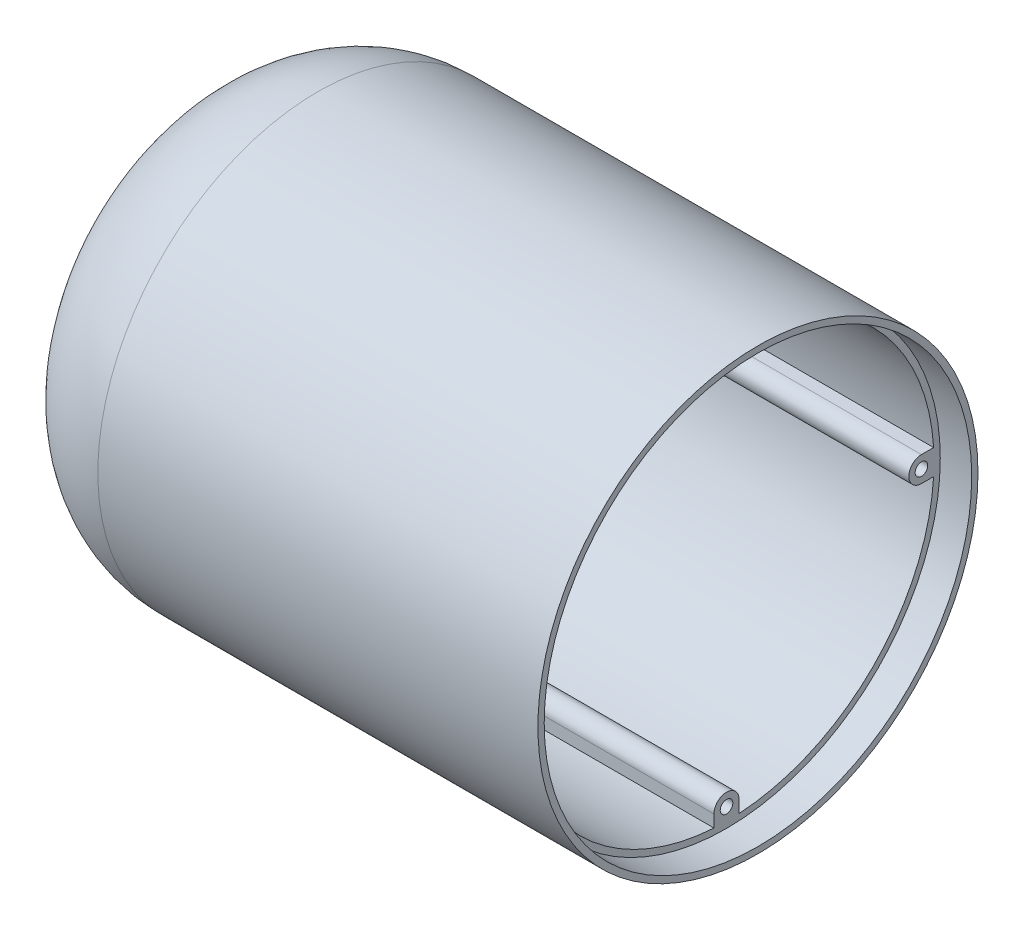
from build123d import *

# Parameters (mm, degrees)
THICKEN1_T2                     = 2
SURFACE_EXTRUDE1_2_DEPTH        = 65
THICKEN2_T1                     = 2
BOSS_EXTRUDE2_REACH             = 83.701
BOSS_EXTRUDE2_END_MAJOR_RADIUS  = 15
BOSS_EXTRUDE2_END_MINOR_RADIUS  = 18
BOSS_EXTRUDE2_DIRECTION_2_DEPTH = 65
SKETCH5_R                       = 1
CUT_EXTRUDE2_DEPTH              = 65
SURFACE_EXTRUDE2_3_DEPTH        = 5
THICKEN3_T1                     = 1


with BuildPart() as body_1:
    # Surface-Revolve1: a surface, the sketch's curves turned about an axis
    with BuildLine(Plane(origin=(0, 0, 0), x_dir=(1, 0, 0), z_dir=(0, 1, 0)), mode=Mode.PRIVATE) as surface_revolve1_1_path:
        Line((0, 0), (0, 15))
        ThreePointArc((0, 15), (5.857864376, 29.142135624), (20, 35))
    surface_revolve1_1 = Shell.revolve(surface_revolve1_1_path.wire(), 360, Axis((0, 0, 0), (1, 0, 0)))
    add(Solid.thicken(surface_revolve1_1, -THICKEN1_T2))

    # Surface-Extrude1: a surface, the sketch's curves swept straight by 65 mm
    with BuildLine(Plane(origin=(20, 0, 0), x_dir=(0, 0, -1), z_dir=(1, 0, 0)), mode=Mode.PRIVATE) as surface_extrude1_2_path:
        CenterArc((0, 0), 35, 0, 360)
    surface_extrude1_2 = Shell.extrude(surface_extrude1_2_path.wire(), (1 * SURFACE_EXTRUDE1_2_DEPTH, 0 * SURFACE_EXTRUDE1_2_DEPTH, 0 * SURFACE_EXTRUDE1_2_DEPTH))
    add(Solid.thicken(surface_extrude1_2, THICKEN2_T1))

    # Boss-Extrude2: up to this torus (the profile starts inside it)
    boss_extrude2_end = Plane(origin=(20, 0, 0), z_dir=(1, 0, 0)) * Torus(BOSS_EXTRUDE2_END_MAJOR_RADIUS, BOSS_EXTRUDE2_END_MINOR_RADIUS, mode=Mode.PRIVATE)
    # Sketch2 → Boss-Extrude2 (add, up to the surface)
    with BuildSketch(Plane(origin=(20, 0, 0), x_dir=(0, 0, -1), z_dir=(1, 0, 0)), mode=Mode.PRIVATE) as boss_extrude2_sk1:
        with BuildLine():
            Line((-2, 31), (-2, 33))
            Line((-2, 33), (2, 33))
            Line((2, 33), (2, 31))
            ThreePointArc((2, 31), (0, 29), (-2, 31))
        make_face()
    boss_extrude2_tool1 = extrude(boss_extrude2_sk1.sketch, amount=-BOSS_EXTRUDE2_REACH, mode=Mode.PRIVATE) & boss_extrude2_end
    add(boss_extrude2_tool1.solids().sort_by_distance((20, 31.1867, 0))[0])
    # Sketch2 → Boss-Extrude2 (add, up to the surface)
    with BuildSketch(Plane(origin=(20, 0, 0), x_dir=(0, 0, -1), z_dir=(1, 0, 0)), mode=Mode.PRIVATE) as boss_extrude2_sk2:
        with BuildLine():
            Line((-31, -2), (-33, -2))
            Line((-33, -2), (-33, 2))
            Line((-33, 2), (-31, 2))
            ThreePointArc((-31, 2), (-29, 0), (-31, -2))
        make_face()
    boss_extrude2_tool2 = extrude(boss_extrude2_sk2.sketch, amount=-BOSS_EXTRUDE2_REACH, mode=Mode.PRIVATE) & boss_extrude2_end
    add(boss_extrude2_tool2.solids().sort_by_distance((20, 0, 31.1867))[0])
    # Sketch2 → Boss-Extrude2 (add, up to the surface)
    with BuildSketch(Plane(origin=(20, 0, 0), x_dir=(0, 0, -1), z_dir=(1, 0, 0)), mode=Mode.PRIVATE) as boss_extrude2_sk3:
        with BuildLine():
            Line((2, -33), (2, -31))
            ThreePointArc((2, -31), (0, -29), (-2, -31))
            Line((-2, -31), (-2, -33))
            Line((-2, -33), (2, -33))
        make_face()
    boss_extrude2_tool3 = extrude(boss_extrude2_sk3.sketch, amount=-BOSS_EXTRUDE2_REACH, mode=Mode.PRIVATE) & boss_extrude2_end
    add(boss_extrude2_tool3.solids().sort_by_distance((20, -31.1867, 0))[0])
    # Sketch2 → Boss-Extrude2 (add, up to the surface)
    with BuildSketch(Plane(origin=(20, 0, 0), x_dir=(0, 0, -1), z_dir=(1, 0, 0)), mode=Mode.PRIVATE) as boss_extrude2_sk4:
        with BuildLine():
            Line((33, 2), (31, 2))
            ThreePointArc((31, 2), (29, 0), (31, -2))
            Line((31, -2), (33, -2))
            Line((33, -2), (33, 2))
        make_face()
    boss_extrude2_tool4 = extrude(boss_extrude2_sk4.sketch, amount=-BOSS_EXTRUDE2_REACH, mode=Mode.PRIVATE) & boss_extrude2_end
    add(boss_extrude2_tool4.solids().sort_by_distance((20, 0, -31.1867))[0])

    # Sketch2 → Boss-Extrude2 direction 2 (add)
    with BuildSketch(Plane(origin=(20, 0, 0), x_dir=(0, 0, -1), z_dir=(1, 0, 0))):
        with BuildLine():
            Line((-2, 31), (-2, 33))
            Line((-2, 33), (2, 33))
            Line((2, 33), (2, 31))
            ThreePointArc((2, 31), (0, 29), (-2, 31))
        make_face()
        with BuildLine():
            Line((-31, -2), (-33, -2))
            Line((-33, -2), (-33, 2))
            Line((-33, 2), (-31, 2))
            ThreePointArc((-31, 2), (-29, 0), (-31, -2))
        make_face()
        with BuildLine():
            Line((2, -33), (2, -31))
            ThreePointArc((2, -31), (0, -29), (-2, -31))
            Line((-2, -31), (-2, -33))
            Line((-2, -33), (2, -33))
        make_face()
        with BuildLine():
            Line((33, 2), (31, 2))
            ThreePointArc((31, 2), (29, 0), (31, -2))
            Line((31, -2), (33, -2))
            Line((33, -2), (33, 2))
        make_face()
    extrude(amount=BOSS_EXTRUDE2_DIRECTION_2_DEPTH)

    # Sketch5 → Cut-Extrude2 (cut)
    with BuildSketch(Plane(origin=(85, 0, 0), x_dir=(0, 0, -1), z_dir=(1, 0, 0))):
        with Locations((0, 31)):
            Circle(SKETCH5_R)
        with Locations((31, 0)):
            Circle(SKETCH5_R)
        with Locations((-31, 0)):
            Circle(SKETCH5_R)
        with Locations((0, -31)):
            Circle(SKETCH5_R)
    extrude(amount=-CUT_EXTRUDE2_DEPTH, mode=Mode.SUBTRACT)

    # Surface-Extrude2: a surface, the sketch's curves swept straight by 5 mm
    with BuildLine(Plane(origin=(85, 0, 0), x_dir=(0, 0, -1), z_dir=(1, 0, 0)), mode=Mode.PRIVATE) as surface_extrude2_3_path:
        CenterArc((0, 0), 35, 0, 360)
    surface_extrude2_3 = Shell.extrude(surface_extrude2_3_path.wire(), (1 * SURFACE_EXTRUDE2_3_DEPTH, 0 * SURFACE_EXTRUDE2_3_DEPTH, 0 * SURFACE_EXTRUDE2_3_DEPTH))
    add(Solid.thicken(surface_extrude2_3, THICKEN3_T1))


solid = body_1.part
